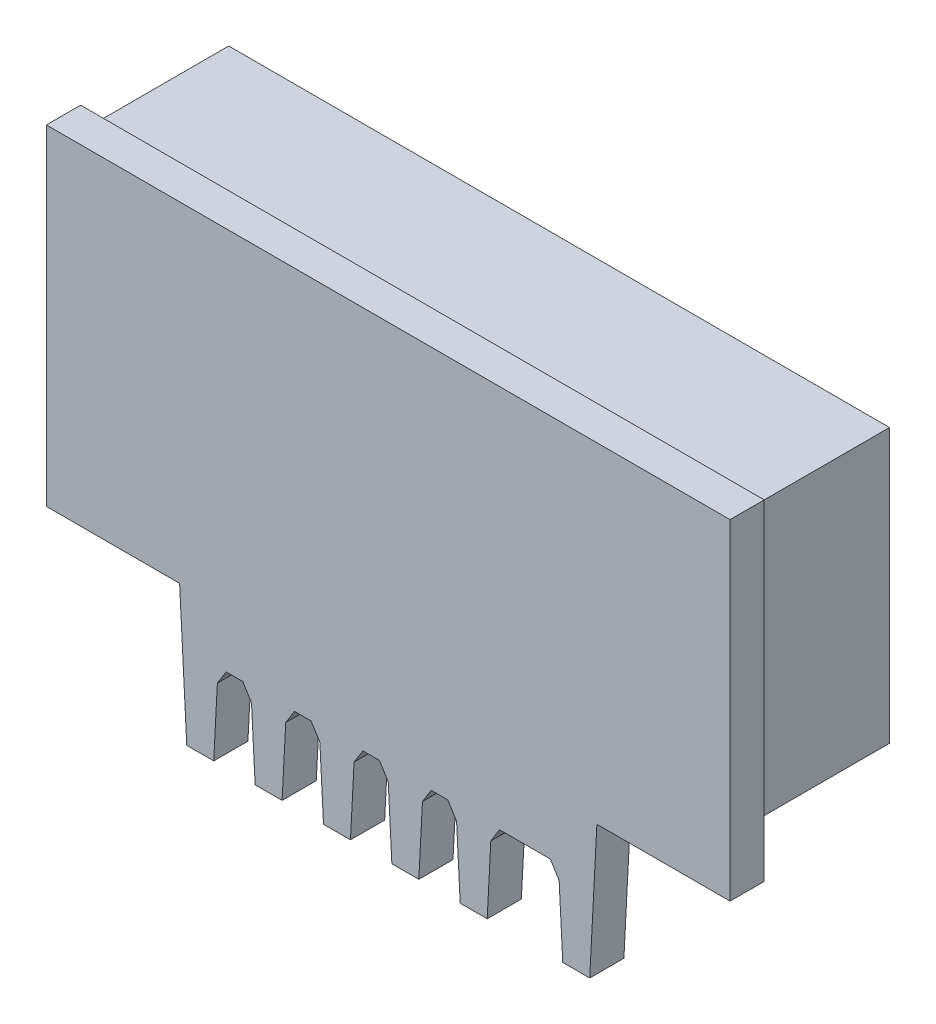
from build123d import *

# Parameters (mm, degrees)
BOSS_EXTRUDE1_DEPTH = 1.5
SKETCH12_W          = 29
SKETCH12_H          = 12
BOSS_EXTRUDE2_DEPTH = 6


with BuildPart() as part:
    # Sketch1 → Boss-Extrude1 (new body)
    with BuildSketch(Plane.XY):
        Polygon((0, 6), (0.314446676, 0), (1.497941481, 0), (1.657221927, 3.039251967), (2.042586863, 3.65596478), (2.769801294, 3.65596478), (3.155166229, 3.039251967), (3.314446676, 0), (4.497941481, 0), (4.657221927, 3.039251967), (5.042586863, 3.65596478), (5.769801294, 3.65596478), (6.155166229, 3.039251967), (6.314446676, 0), (7.497941481, 0), (7.657221927, 3.039251967), (8.042586863, 3.65596478), (8.769801294, 3.65596478), (9.155166229, 3.039251967), (9.314446676, 0), (10.497941481, 0), (10.657221927, 3.039251967), (11.042586863, 3.65596478), (11.769801294, 3.65596478), (12.155166229, 3.039251967), (12.314446676, 0), (13.497941481, 0), (13.657221927, 3.039251967), (14.042586863, 3.65596478), (16.269801294, 3.65596478), (16.655166229, 3.039251967), (16.814446676, 0), (17.997941481, 0), (18.312388157, 6), (24.156194078, 6), (24.156194078, 20.5), (-5.843805922, 20.5), (-5.843805922, 6), align=None)
    extrude(amount=BOSS_EXTRUDE1_DEPTH)

    # Sketch12 → Boss-Extrude2 (add)
    with BuildSketch(Plane.XY):
        with Locations((9.156194078, 14)):
            Rectangle(SKETCH12_W, SKETCH12_H)
    extrude(amount=-BOSS_EXTRUDE2_DEPTH)


solid = part.part
